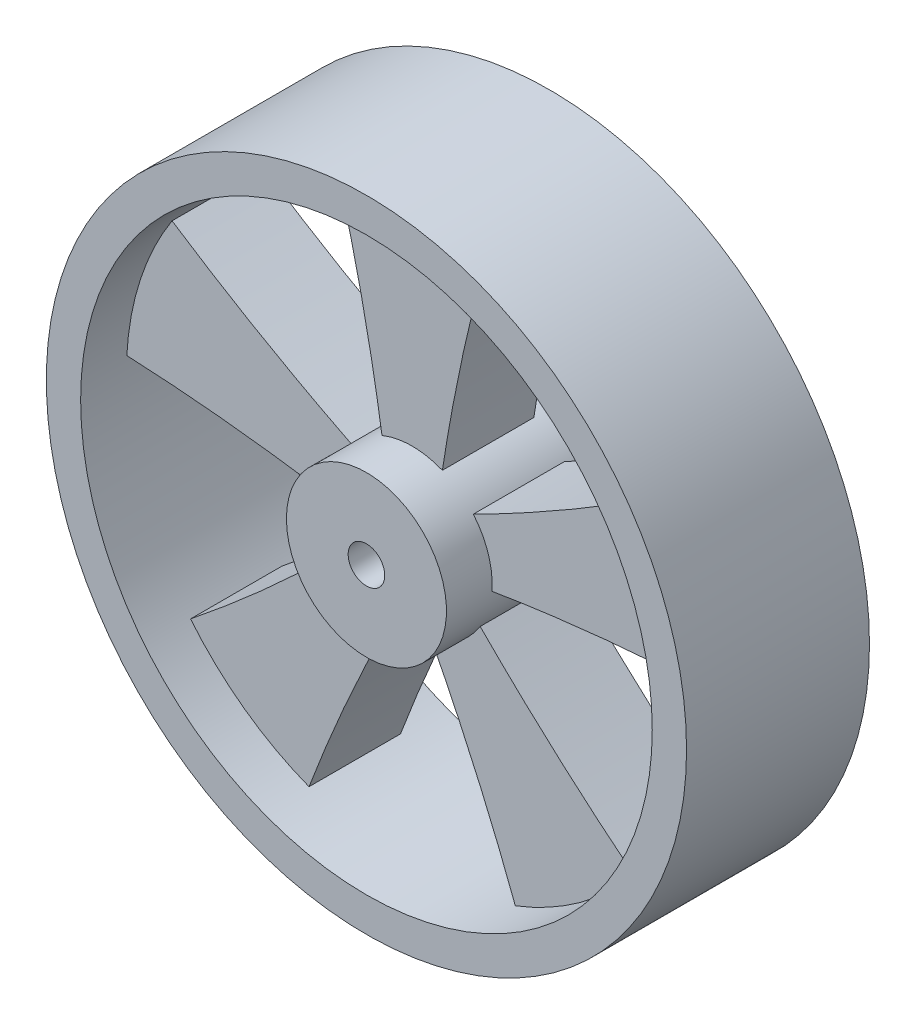
from build123d import *

# Parameters (mm, degrees)
SKETCH1_R           = 70
SKETCH1_R_2         = 62.278635001
SKETCH1_R_3         = 17.121532135
SKETCH1_R_4         = 4
BOSS_EXTRUDE1_DEPTH = 20
SKETCH2_R           = 62.5
SKETCH2_R_2         = 17.5
CUT_EXTRUDE1_DEPTH  = 10
CUT_EXTRUDE2_DEPTH  = 104.440804328


with BuildPart() as part:
    # Sketch1 → Boss-Extrude1 (new, symmetric)
    # profile 1 of 3: a face of its own
    with BuildSketch(Plane.XY):
        Circle(SKETCH1_R)
        Circle(SKETCH1_R_2, mode=Mode.SUBTRACT)
    # profile 2 of 3: a face of its own
    with BuildSketch(Plane.XY):
        Circle(SKETCH1_R_2)
        Circle(SKETCH1_R_3, mode=Mode.SUBTRACT)
    # profile 3 of 3: a face of its own
    with BuildSketch(Plane.XY):
        Circle(SKETCH1_R_3)
        Circle(SKETCH1_R_4, mode=Mode.SUBTRACT)
    extrude(amount=BOSS_EXTRUDE1_DEPTH, both=True)

    # Sketch2 → Cut-Extrude1 (cut)
    with BuildSketch(Plane(origin=(0, 0, -20), x_dir=(-1, 0, 0), z_dir=(0, 0, -1))):
        Circle(SKETCH2_R)
        Circle(SKETCH2_R_2, mode=Mode.SUBTRACT)
    cut_extrude1 = extrude(amount=-CUT_EXTRUDE1_DEPTH, mode=Mode.SUBTRACT)

    # Mirror1: Cut-Extrude1 across plane
    add(cut_extrude1.mirror(Plane.XY), mode=Mode.SUBTRACT)

    # Sketch3 → Cut-Extrude2 (cut, through all)
    with BuildSketch(Plane(origin=(0, 0, -10), x_dir=(-1, 0, 0), z_dir=(0, 0, -1))):
        with BuildLine():
            add(Edge.make_bspline(
                [(-16.012184604, 60.414070747), (-10.028198069, 38.589231507), (-6.603566708, 16.206261343)],
                knots=[0, 0, 0, 1, 1, 1], degree=2))
            ThreePointArc((-16.012184604, 60.414070747), (-36.736578268, 50.563562148), (-52.5091585, 33.897467068))
            add(Edge.make_bspline(
                [(-52.5091585, 33.897467068), (-33.601656457, 21.462111455), (-13.372456119, 11.288375319)],
                knots=[0, 0, 0, 1, 1, 1], degree=2))
            ThreePointArc((-13.372456119, 11.288375319), (-10.286241915, 14.157797402), (-6.603566708, 16.206261343))
        make_face()
        with BuildLine():
            add(Edge.make_bspline(
                [(52.5091585, 33.897467068), (33.601656457, 21.462111455), (13.372456119, 11.288375319)],
                knots=[0, 0, 0, 1, 1, 1], degree=2))
            ThreePointArc((52.5091585, 33.897467068), (36.736578268, 50.563562148), (16.012184604, 60.414070747))
            add(Edge.make_bspline(
                [(16.012184604, 60.414070747), (10.028198069, 38.589231507), (6.603566708, 16.206261343)],
                knots=[0, 0, 0, 1, 1, 1], degree=2))
            ThreePointArc((6.603566708, 16.206261343), (10.286241915, 14.157797402), (13.372456119, 11.288375319))
        make_face()
        with BuildLine():
            ThreePointArc((48.464629278, -39.464283966), (58.886710427, -20.942906557), (62.5, 0))
            ThreePointArc((62.5, 0), (62.476303713, 1.720893487), (62.405232819, 3.440482052))
            add(Edge.make_bspline(
                [(62.405232819, 3.440482052), (39.79942371, 2.387345216), (17.453684792, -1.272354978)],
                knots=[0, 0, 0, 1, 1, 1], degree=2))
            ThreePointArc((17.453684792, -1.272354978), (16.643489035, -5.407797402), (14.868199103, -9.229661719))
            add(Edge.make_bspline(
                [(48.464629278, -39.464283966), (30.795163838, -25.324917157), (14.868199103, -9.229661719)],
                knots=[0, 0, 0, 1, 1, 1], degree=2))
        make_face()
        with BuildLine():
            ThreePointArc((-62.405232819, 3.440482052), (-59.441032268, -19.313562148), (-48.464629278, -39.464283966))
            add(Edge.make_bspline(
                [(-48.464629278, -39.464283966), (-30.795163838, -25.324917157), (-14.868199103, -9.229661719)],
                knots=[0, 0, 0, 1, 1, 1], degree=2))
            ThreePointArc((-14.868199103, -9.229661719), (-16.643489035, -5.407797402), (-17.453684792, -1.272354978))
            add(Edge.make_bspline(
                [(-62.405232819, 3.440482052), (-39.79942371, 2.387345216), (-17.453684792, -1.272354978)],
                knots=[0, 0, 0, 1, 1, 1], degree=2))
        make_face()
        with BuildLine():
            ThreePointArc((-22.556370354, -58.287735901), (0, -62.5), (22.556370354, -58.287735901))
            add(Edge.make_bspline(
                [(22.556370354, -58.287735901), (14.569198516, -37.113771021), (4.183403722, -16.992619966)],
                knots=[0, 0, 0, 1, 1, 1], degree=2))
            ThreePointArc((4.183403722, -16.992619966), (0, -17.5), (-4.183403722, -16.992619966))
            add(Edge.make_bspline(
                [(-22.556370354, -58.287735901), (-14.569198516, -37.113771021), (-4.183403722, -16.992619966)],
                knots=[0, 0, 0, 1, 1, 1], degree=2))
        make_face()
    extrude(amount=-CUT_EXTRUDE2_DEPTH, mode=Mode.SUBTRACT)


solid = part.part
